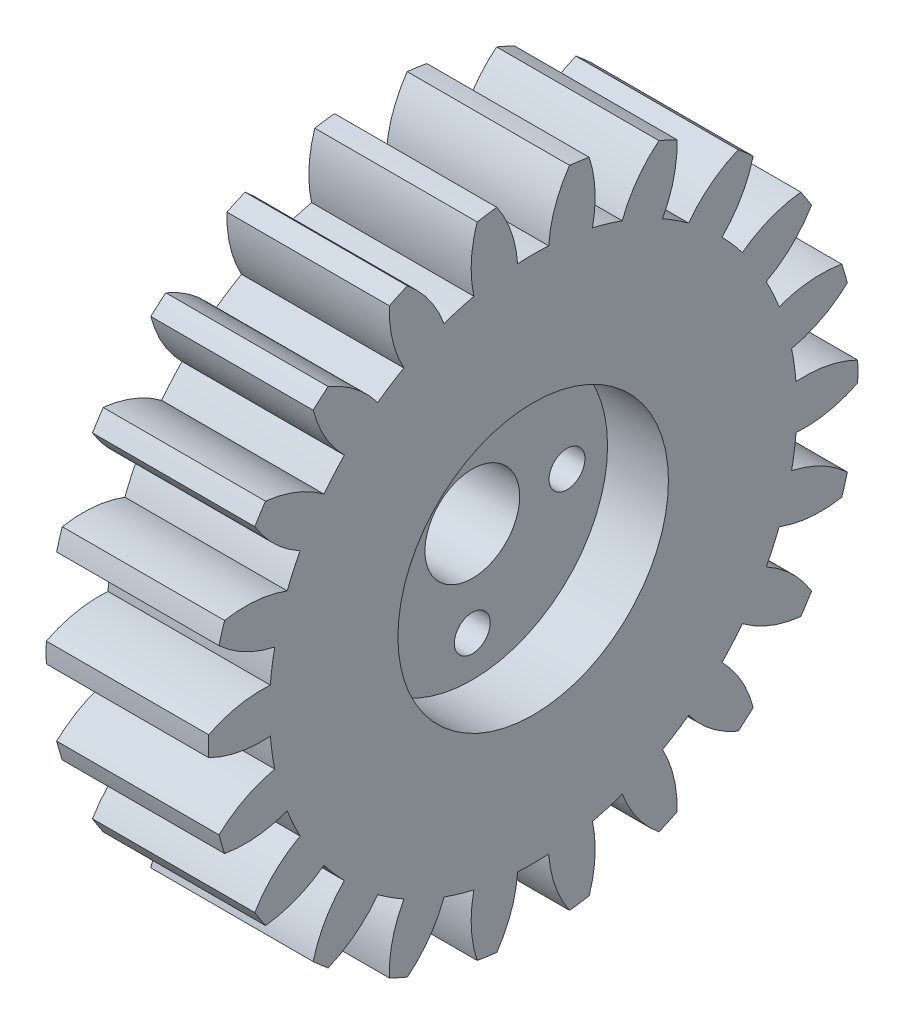
from build123d import *

# Parameters (mm, degrees)
BASPROSKE_W        = 12
BASPROSKE_H        = 24
TOOTHCUT_DEPTH     = 37
TEETHCUTS_COUNT    = 22
TEETHCUTS_ANGLE    = 343.636363636
BORSKE_R           = 3
BORE_DEPTH         = 50.0000508
SKETCH1_R          = 10
CUT_EXTRUDE1_DEPTH = 4.5
CUT_EXTRUDE2_REACH = 36.656
SKETCH2_R          = 3.5
CUT_EXTRUDE3_REACH = 36.656
SKETCH3_R          = 1.325


with BuildPart() as part:
    # BasProSke → Base-Revolve (revolve)
    with BuildSketch(Plane(origin=(0, 0, 0), x_dir=(1, 0, 0), z_dir=(0, 1, 0)), mode=Mode.PRIVATE) as base_revolve_sk:
        with Locations((6, 12)):
            Rectangle(BASPROSKE_W, BASPROSKE_H)
    revolve(base_revolve_sk.sketch.rotate(Axis((-10, 0, 0), (1, 0, 0)), 180), axis=Axis((-10, 0, 0), (1, 0, 0)))

    # TooCutSke → ToothCut (cut, through all)
    with BuildSketch(Plane(origin=(0, 0, 0), x_dir=(0, 0, -1), z_dir=(1, 0, 0))):
        with BuildLine():
            ThreePointArc((1.148067356, 19.465172549), (0, 19.499), (-1.148067356, 19.465172549))
            ThreePointArc((-1.148067356, 19.465172549), (-1.628029232, 21.774154728), (-2.703966408, 23.872754571))
            ThreePointArc((-2.703966408, 23.872754571), (0, 24.0254), (2.703966408, 23.872754571))
            ThreePointArc((2.703966408, 23.872754571), (1.628029232, 21.774154728), (1.148067356, 19.465172549))
        make_face()
    toothcut = extrude(amount=TOOTHCUT_DEPTH, mode=Mode.SUBTRACT)

    # TeethCuts: ToothCut ×22 about axis
    teethcuts_axis = Axis((-10, 0, 0), (1, 0, 0))
    for i in range(1, TEETHCUTS_COUNT):
        add(toothcut.rotate(teethcuts_axis, i * TEETHCUTS_ANGLE / (TEETHCUTS_COUNT - 1)), mode=Mode.SUBTRACT)

    # BorSke → Bore (cut, symmetric)
    with BuildSketch(Plane(origin=(0, 0, 0), x_dir=(0, 0, -1), z_dir=(1, 0, 0))):
        with Locations(Location((0, 0, 0), (0, 0, 180))):
            Circle(BORSKE_R)
    extrude(amount=BORE_DEPTH, both=True, mode=Mode.SUBTRACT)

    # Sketch1 → Cut-Extrude1 (cut)
    with BuildSketch(Plane(origin=(12, 0, 0), x_dir=(0, 0, -1), z_dir=(1, 0, 0))):
        Circle(SKETCH1_R)
    extrude(amount=-CUT_EXTRUDE1_DEPTH, mode=Mode.SUBTRACT)

    # Sketch2 → Cut-Extrude2 (cut, up to next)
    with BuildSketch(Plane(origin=(7.5, 0, 0), x_dir=(0, 0, -1), z_dir=(1, 0, 0)), mode=Mode.PRIVATE) as cut_extrude2_sk1:
        Circle(SKETCH2_R)
    cut_extrude2_tool1 = extrude(cut_extrude2_sk1.sketch, amount=-CUT_EXTRUDE2_REACH, mode=Mode.PRIVATE) & part.part
    add(cut_extrude2_tool1.solids().sort_by_distance((7.5, 0, 0))[0], mode=Mode.SUBTRACT)

    # Sketch3 → Cut-Extrude3 (cut, up to next)
    with BuildSketch(Plane(origin=(7.5, 0, 0), x_dir=(0, 0, -1), z_dir=(1, 0, 0)), mode=Mode.PRIVATE) as cut_extrude3_sk1:
        with Locations((0, 7)):
            Circle(SKETCH3_R)
    cut_extrude3_tool1 = extrude(cut_extrude3_sk1.sketch, amount=-CUT_EXTRUDE3_REACH, mode=Mode.PRIVATE) & part.part
    # Sketch3 → Cut-Extrude3 (cut, up to next)
    with BuildSketch(Plane(origin=(7.5, 0, 0), x_dir=(0, 0, -1), z_dir=(1, 0, 0)), mode=Mode.PRIVATE) as cut_extrude3_sk2:
        with Locations((7, 0)):
            Circle(SKETCH3_R)
    cut_extrude3_tool2 = extrude(cut_extrude3_sk2.sketch, amount=-CUT_EXTRUDE3_REACH, mode=Mode.PRIVATE) & part.part
    # Sketch3 → Cut-Extrude3 (cut, up to next)
    with BuildSketch(Plane(origin=(7.5, 0, 0), x_dir=(0, 0, -1), z_dir=(1, 0, 0)), mode=Mode.PRIVATE) as cut_extrude3_sk3:
        with Locations((0, -7)):
            Circle(SKETCH3_R)
    cut_extrude3_tool3 = extrude(cut_extrude3_sk3.sketch, amount=-CUT_EXTRUDE3_REACH, mode=Mode.PRIVATE) & part.part
    # Sketch3 → Cut-Extrude3 (cut, up to next)
    with BuildSketch(Plane(origin=(7.5, 0, 0), x_dir=(0, 0, -1), z_dir=(1, 0, 0)), mode=Mode.PRIVATE) as cut_extrude3_sk4:
        with Locations((-7, 0)):
            Circle(SKETCH3_R)
    cut_extrude3_tool4 = extrude(cut_extrude3_sk4.sketch, amount=-CUT_EXTRUDE3_REACH, mode=Mode.PRIVATE) & part.part
    add(cut_extrude3_tool1.solids().sort_by_distance((7.5, 7, 0))[0], mode=Mode.SUBTRACT)
    add(cut_extrude3_tool2.solids().sort_by_distance((7.5, 0, -7))[0], mode=Mode.SUBTRACT)
    add(cut_extrude3_tool3.solids().sort_by_distance((7.5, -7, 0))[0], mode=Mode.SUBTRACT)
    add(cut_extrude3_tool4.solids().sort_by_distance((7.5, 0, 7))[0], mode=Mode.SUBTRACT)


solid = part.part
